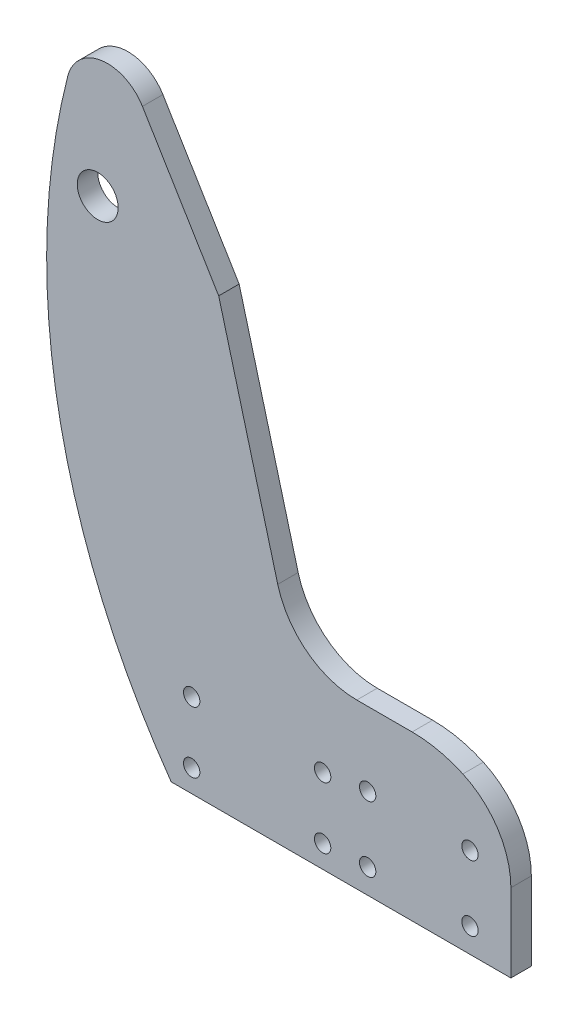
from build123d import *

# Parameters (mm, degrees)
SKETCH_1_W          = 83
SKETCH_1_H          = 28
EXTRUDE_1_DEPTH     = 5
SKETCH_2_R          = 2
CUT_EXTRUDE_1_DEPTH = 45.082309377
EXTRUDE_2_DEPTH     = 5
CUT_EXTRUDE_3_DEPTH = 156.991954214
FILLET_4_R          = 30
FILLET_5_R          = 20
SKETCH_6_R          = 2
CUT_EXTRUDE_4_DEPTH = 156.991954214
EXTRUDE_3_DEPTH     = 5
FILLET_7_R          = 10
SKETCH_8_R          = 5
CUT_EXTRUDE_5_DEPTH = 149.879193137
FILLET_8_R          = 20


with BuildPart() as part:
    # 草图1 → 凸台-拉伸1 (new body)
    with BuildSketch(Plane.XY):
        Rectangle(SKETCH_1_W, SKETCH_1_H)
    extrude(amount=EXTRUDE_1_DEPTH)

    # 草图2 → 切除-拉伸1 (cut, through all)
    with BuildSketch(Plane.XY.offset(5)):
        with Locations((6.5, 8)):
            Circle(SKETCH_2_R)
        with Locations((31.5, 8)):
            Circle(SKETCH_2_R)
        with Locations((31.5, -8)):
            Circle(SKETCH_2_R)
        with Locations((6.5, -8)):
            Circle(SKETCH_2_R)
    extrude(amount=-CUT_EXTRUDE_1_DEPTH, mode=Mode.SUBTRACT)

    # 草图3 → 凸台-拉伸2 (add)
    with BuildSketch(Plane(origin=(0, 0, 0), x_dir=(-1, 0, 0), z_dir=(0, 0, -1))):
        Polygon((41.5, 14), (59.770308511, 144), (29.5, 94), (-41.5, 14), align=None)
    extrude(amount=-EXTRUDE_2_DEPTH)

    # 草图5 → 切除-拉伸3 (cut, through all)
    with BuildSketch(Plane.XY.offset(5)):
        Polygon((36.5, 26), (-11.5, 26), (-35.602469952, 115.951642448), align=None)
    extrude(amount=-CUT_EXTRUDE_3_DEPTH, mode=Mode.SUBTRACT)

    # 圆角4
    fillet_4_edges = [part.edges().sort_by_distance(p)[0] for p in [
        (30.85, 26, 2.5),
    ]]
    fillet(fillet_4_edges, radius=FILLET_4_R)

    # 圆角5
    fillet_5_edges = [part.edges().sort_by_distance(p)[0] for p in [
        (-11.5, 26, 2.5),
    ]]
    fillet(fillet_5_edges, radius=FILLET_5_R)

    # 草图6 → 切除-拉伸4 (cut, through all)
    with BuildSketch(Plane.XY.offset(5)):
        with Locations((-36.5, -8.5)):
            Circle(SKETCH_6_R)
        with Locations((-4.5, -8.5)):
            Circle(SKETCH_6_R)
        with Locations((-4.5, 6.5)):
            Circle(SKETCH_6_R)
        with Locations((-36.5, 6.5)):
            Circle(SKETCH_6_R)
    extrude(amount=-CUT_EXTRUDE_4_DEPTH, mode=Mode.SUBTRACT)

    # 草图7 → 凸台-拉伸3 (add)
    with BuildSketch(Plane.XY.offset(5)):
        with BuildLine():
            Line((-41.5, 14), (-41.5, -14))
            ThreePointArc((-41.5, -14), (-70.837432371, 62.663912318), (-59.770308511, 144))
            Line((-59.770308511, 144), (-41.5, 14))
        make_face()
    extrude(amount=-EXTRUDE_3_DEPTH)

    # 圆角7
    fillet_7_edges = [part.edges().sort_by_distance(p)[0] for p in [
        (-59.770308511, 144, 2.5),
    ]]
    fillet(fillet_7_edges, radius=FILLET_7_R)

    # 草图8 → 切除-拉伸5 (cut, through all)
    with BuildSketch(Plane.XY.offset(5)):
        with Locations((-59.455425686, 101)):
            Circle(SKETCH_8_R)
    extrude(amount=-CUT_EXTRUDE_5_DEPTH, mode=Mode.SUBTRACT)

    # 圆角8
    fillet_8_edges = [part.edges().sort_by_distance(p)[0] for p in [
        (41.5, 14, 2.5),
    ]]
    fillet(fillet_8_edges, radius=FILLET_8_R)


solid = part.part
